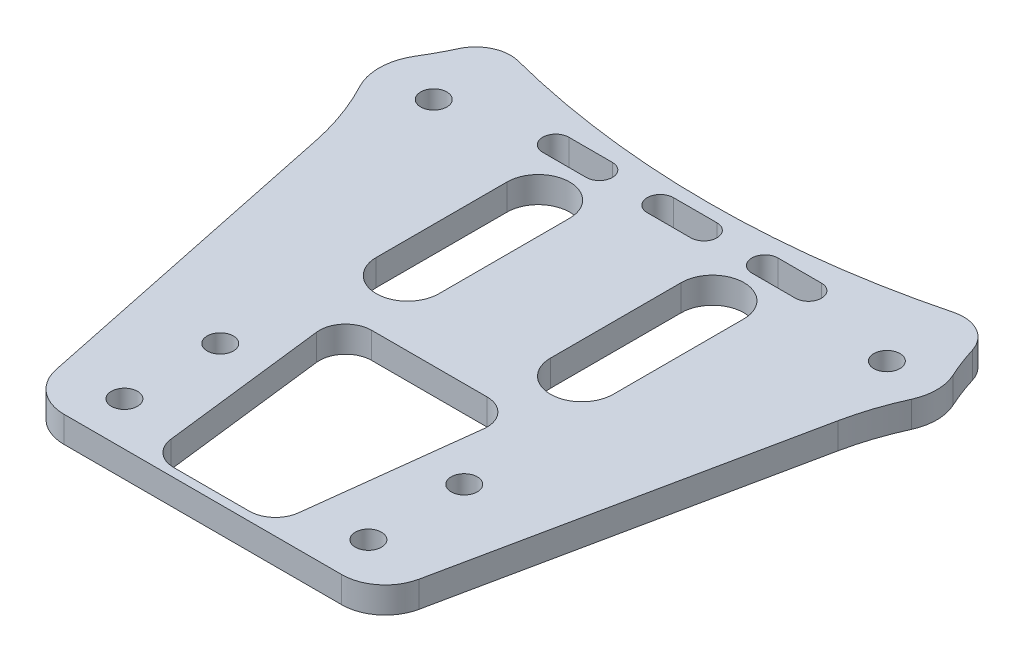
from build123d import *

# Parameters (mm, degrees)
SKETCH_1_R          = 1.5
EXTRUDE_1_DEPTH     = 3
SKETCH_2_R          = 1.5
CUT_EXTRUDE_1_DEPTH = 55.166410256
EXTRUDE_2_DEPTH     = 3
CUT_EXTRUDE_2_DEPTH = 55.166410256
CUT_EXTRUDE_3_DEPTH = 3
FILLET_1_R          = 3
EXTRUDE_3_DEPTH     = 3
FILLET_3_R          = 4
SKETCH_9_W          = 40
SKETCH_9_H          = 28
CUT_EXTRUDE_4_DEPTH = 10
FILLET_4_R          = 5
SKETCH_11_R         = 6.275308726
SKETCH_11_R_2       = 1.5
SKETCH_11_R_3       = 5.719245844
EXTRUDE_4_DEPTH     = 3
FILLET_5_R          = 30


with BuildPart() as part:
    # 草图1 → 凸台-拉伸1 (new body)
    with BuildSketch(Plane(origin=(0, 0, 0), x_dir=(1, 0, 0), z_dir=(0, 1, 0))):
        with BuildLine():
            Line((-17.5, -25), (-30, -25))
            Line((-30, -25), (-30, 25))
            Line((-30, 25), (-30, 29.606079858))
            ThreePointArc((-30, 29.606079858), (0, 25), (30, 29.606079858))
            Line((30, 29.606079858), (30, 25))
            Line((30, 25), (30, -25))
            Line((30, -25), (17.5, -25))
            Line((17.5, -25), (17.5, -45))
            Line((17.5, -45), (-17.5, -45))
            Line((-17.5, -45), (-17.5, -25))
        make_face()
        with Locations(Location((-14, -17, 0), (0, 0, 270))):
            Circle(SKETCH_1_R, mode=Mode.SUBTRACT)
        with Locations(Location((14, -17, 0), (0, 0, 90))):
            Circle(SKETCH_1_R, mode=Mode.SUBTRACT)
        with Locations(Location((-14, -28, 0), (0, 0, 270))):
            Circle(SKETCH_1_R, mode=Mode.SUBTRACT)
        with Locations(Location((14, -28, 0), (0, 0, 90))):
            Circle(SKETCH_1_R, mode=Mode.SUBTRACT)
        with BuildLine():
            Line((9.5, 20.5), (14.5, 20.5))
            ThreePointArc((14.5, 20.5), (16, 22), (14.5, 23.5))
            Line((14.5, 23.5), (9.5, 23.5))
            ThreePointArc((9.5, 23.5), (8, 22), (9.5, 20.5))
        make_face(mode=Mode.SUBTRACT)
        with BuildLine():
            Line((-2.5, 23.5), (2.5, 23.5))
            ThreePointArc((2.5, 23.5), (4, 22), (2.5, 20.5))
            Line((2.5, 20.5), (-2.5, 20.5))
            ThreePointArc((-2.5, 20.5), (-4, 22), (-2.5, 23.5))
        make_face(mode=Mode.SUBTRACT)
        with BuildLine():
            Line((-14.5, 23.5), (-9.5, 23.5))
            ThreePointArc((-9.5, 23.5), (-8, 22), (-9.5, 20.5))
            Line((-9.5, 20.5), (-14.5, 20.5))
            ThreePointArc((-14.5, 20.5), (-16, 22), (-14.5, 23.5))
        make_face(mode=Mode.SUBTRACT)
    extrude(amount=EXTRUDE_1_DEPTH)

    # 草图2 → 切除-拉伸1 (cut, through all)
    with BuildSketch(Plane(origin=(0, 3, 0), x_dir=(1, 0, 0), z_dir=(0, 1, 0))):
        with Locations(Location((-26, 19.5, 0), (0, 0, 270))):
            Circle(SKETCH_2_R)
        with Locations(Location((26, 19.5, 0), (0, 0, 90))):
            Circle(SKETCH_2_R)
        with BuildLine():
            Line((-6.4, 15.5), (-6.4, 0.5))
            ThreePointArc((-6.4, 0.5), (-10, -3.1), (-13.6, 0.5))
            Line((-13.6, 0.5), (-13.6, 15.5))
            ThreePointArc((-13.6, 15.5), (-10, 19.1), (-6.4, 15.5))
        make_face()
        with BuildLine():
            Line((6.4, 15.5), (6.4, 0.5))
            ThreePointArc((6.4, 0.5), (10, -3.1), (13.6, 0.5))
            Line((13.6, 0.5), (13.6, 15.5))
            ThreePointArc((13.6, 15.5), (10, 19.1), (6.4, 15.5))
        make_face()
    extrude(amount=-CUT_EXTRUDE_1_DEPTH, mode=Mode.SUBTRACT)

    # 草图3 → 凸台-拉伸2 (add)
    with BuildSketch(Plane(origin=(0, 3, 0), x_dir=(1, 0, 0), z_dir=(0, 1, 0))):
        Polygon((-30, -25), (-17.5, -45), (-17.5, -25), align=None)
        Polygon((17.5, -25), (17.5, -45), (30, -25), align=None)
    extrude(amount=-EXTRUDE_2_DEPTH)

    # 草图4 → 切除-拉伸2 (cut, through all)
    with BuildSketch(Plane(origin=(0, 3, 0), x_dir=(1, 0, 0), z_dir=(0, 1, 0))):
        Polygon((-30, 15), (-17.5, -45), (-30, -25), align=None)
        Polygon((17.5, -45), (30, -25), (30, 15), align=None)
    extrude(amount=-CUT_EXTRUDE_2_DEPTH, mode=Mode.SUBTRACT)

    # 草图6 → 切除-拉伸3 (cut)
    with BuildSketch(Plane(origin=(0, 3, 0), x_dir=(1, 0, 0), z_dir=(0, 1, 0))):
        Polygon((-10, -7), (10, -7), (7, -32), (-7, -32), align=None)
    extrude(amount=-CUT_EXTRUDE_3_DEPTH, mode=Mode.SUBTRACT)

    # 圆角1
    fillet_1_edges = [part.edges().sort_by_distance(p)[0] for p in [
        (10, 1.5, 7),
        (7, 1.5, 32),
        (-7, 1.5, 32),
        (-10, 1.5, 7),
    ]]
    fillet(fillet_1_edges, radius=FILLET_1_R)

    # 草图8 → 凸台-拉伸3 (add)
    with BuildSketch(Plane(origin=(0, 3, 0), x_dir=(1, 0, 0), z_dir=(0, 1, 0))):
        Polygon((-17.5, -45), (-17.083333333, -47), (17.083333333, -47), (17.5, -45), align=None)
    extrude(amount=-EXTRUDE_3_DEPTH)

    # 圆角3
    fillet_3_edges = [part.edges().sort_by_distance(p)[0] for p in [
        (-30, 1.5, -15),
        (30, 1.5, -15),
        (-30, 1.5, -29.606079858),
        (30, 1.5, -29.606079858),
        (17.083333333, 1.5, 47),
        (-17.083333333, 1.5, 47),
    ]]
    fillet(fillet_3_edges, radius=FILLET_3_R)

    # 草图9 → 切除-拉伸4 (cut)
    with BuildSketch(Plane(origin=(0, 3, 0), x_dir=(1, 0, 0), z_dir=(0, 1, 0))):
        with Locations((0, -47)):
            Rectangle(SKETCH_9_W, SKETCH_9_H)
    extrude(amount=-CUT_EXTRUDE_4_DEPTH, mode=Mode.SUBTRACT)

    # 圆角4
    fillet_4_edges = [part.edges().sort_by_distance(p)[0] for p in [
        (-20, 1.5, 33),
        (20, 1.5, 33),
    ]]
    fillet(fillet_4_edges, radius=FILLET_4_R)

    # 草图11 → 凸台-拉伸4 (add)
    # profile 1 of 2: a face of its own
    with BuildSketch(Plane(origin=(0, 3, 0), x_dir=(1, 0, 0), z_dir=(0, 1, 0))):
        with Locations((-26, 19.5)):
            Circle(SKETCH_11_R)
        with Locations(Location((-26, 19.5, 0), (0, 0, 270))):
            Circle(SKETCH_11_R_2, mode=Mode.SUBTRACT)
    # profile 2 of 2: a face of its own
    with BuildSketch(Plane(origin=(0, 3, 0), x_dir=(1, 0, 0), z_dir=(0, 1, 0))):
        with Locations((26, 19.5)):
            Circle(SKETCH_11_R_3)
        with Locations(Location((26, 19.5, 0), (0, 0, 90))):
            Circle(SKETCH_11_R_2, mode=Mode.SUBTRACT)
    extrude(amount=-EXTRUDE_4_DEPTH)

    # 圆角5
    fillet_5_edges = [part.edges().sort_by_distance(p)[0] for p in [
        (30, 1.5, -15.412241075),
        (30, 1.5, -23.587758925),
        (-29.915921679, 1.5, -14.596424059),
        (-29.999864579, 1.5, -24.335347242),
    ]]
    fillet(fillet_5_edges, radius=FILLET_5_R)


solid = part.part
